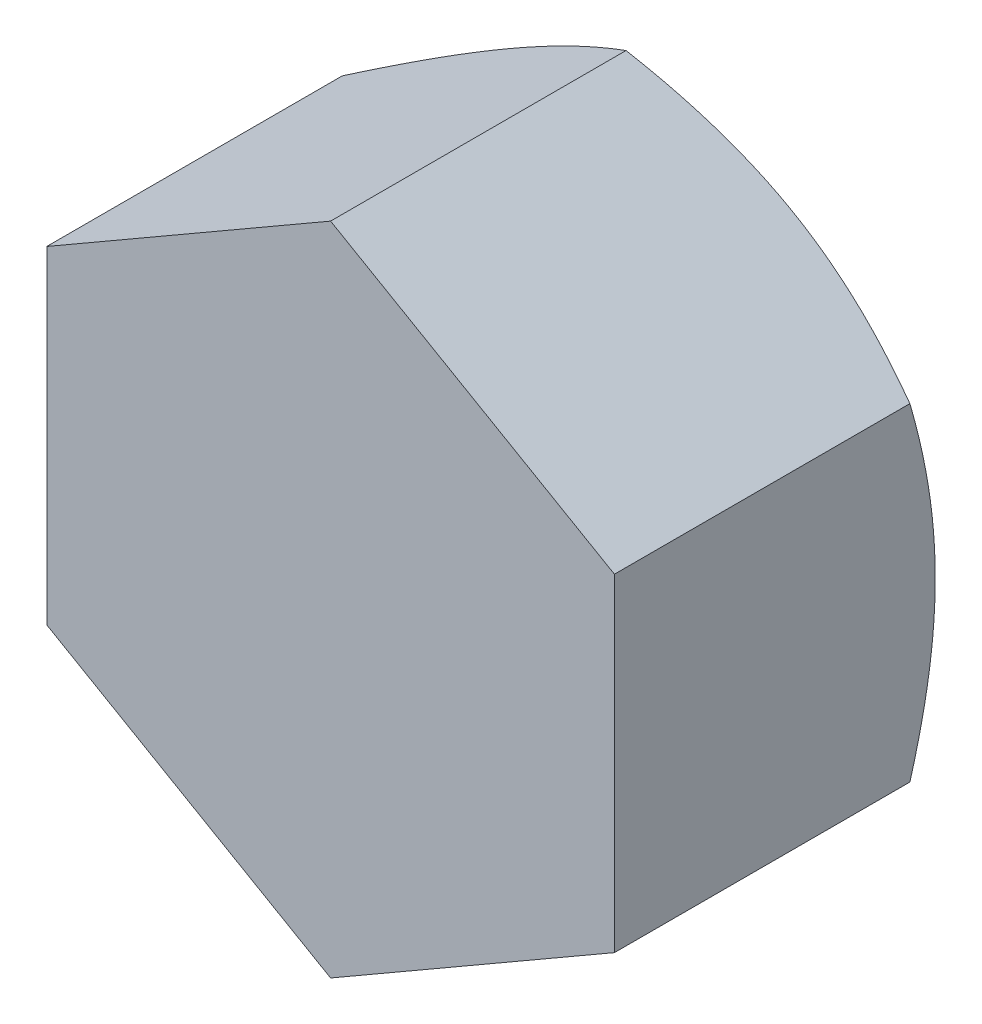
from build123d import *

# Parameters (mm, degrees)
EXTRUDE_1_DEPTH = 30


with BuildPart() as part:
    # 草图1 → 凸台-拉伸1 (new body)
    with BuildSketch(Plane.XY):
        Polygon((25, -14.43375673), (25, 14.43375673), (0, 28.867513459), (-25, 14.43375673), (-25, -14.43375673), (0, -28.867513459), align=None)
    extrude(amount=EXTRUDE_1_DEPTH)

    # 草图2 → 切除-旋转1 (revolve, cut)
    with BuildSketch(Plane(origin=(0, 0, 0), x_dir=(0, 0, -1), z_dir=(1, 0, 0)), mode=Mode.PRIVATE) as cut_revolve_1_sk:
        Polygon((-4, 28.908520158), (0.613826619, 20.917138036), (0.613826619, 32.83436024), align=None)
    revolve(cut_revolve_1_sk.sketch.rotate(Axis((0, 0, -10.704078941), (0, 0, 1)), 270), axis=Axis((0, 0, -10.704078941), (0, 0, 1)), mode=Mode.SUBTRACT)


solid = part.part
